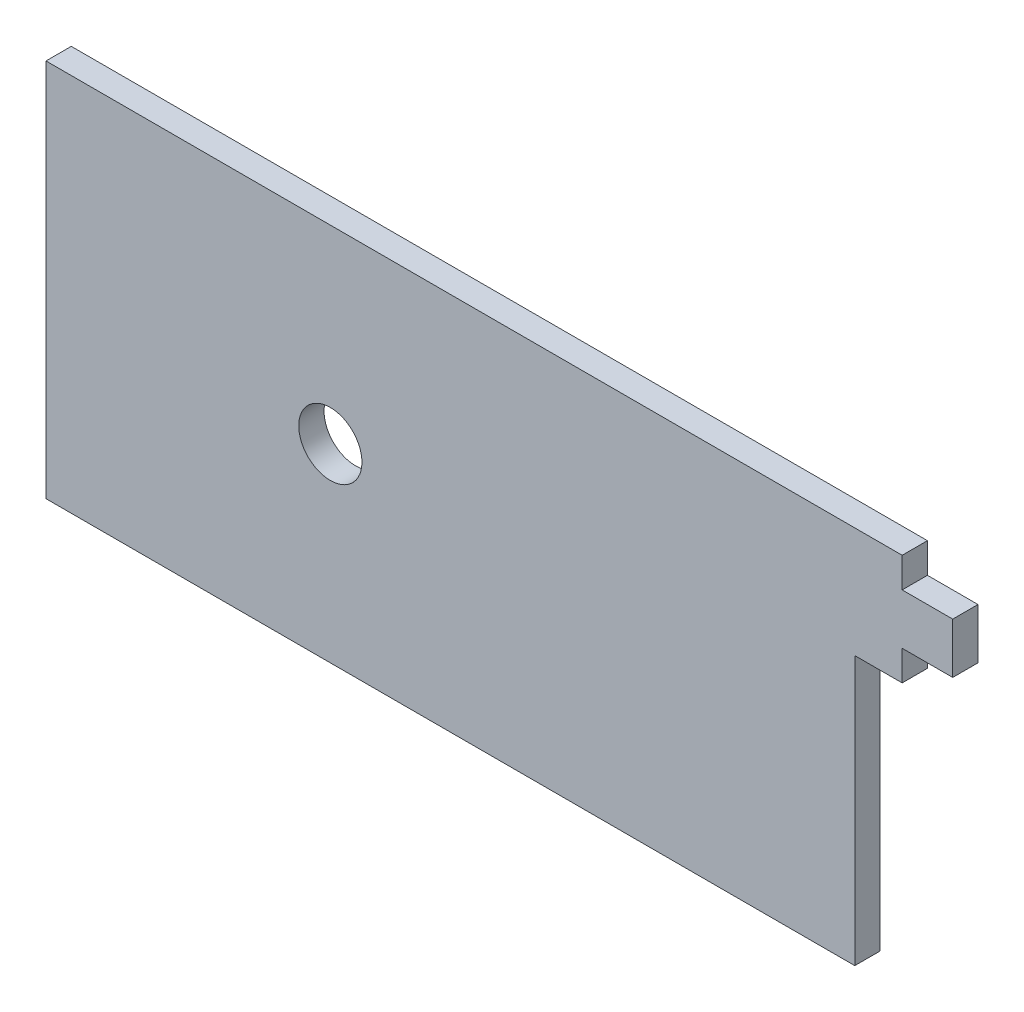
from build123d import *

# Parameters (mm, degrees)
SKETCH1_R           = 5
BOSS_EXTRUDE1_DEPTH = 4


with BuildPart() as part:
    # Sketch1 → Boss-Extrude1 (new body)
    with BuildSketch(Plane.XY):
        Polygon((47, 30), (54.5, 30), (54.5, 25.25), (62.5, 25.25), (62.5, 17.25), (54.5, 17.25), (54.5, 12.5), (47, 12.5), (47, -30), (-81, -30), (-81, 30), align=None)
        with Locations((-36, 0)):
            Circle(SKETCH1_R, mode=Mode.SUBTRACT)
    extrude(amount=BOSS_EXTRUDE1_DEPTH)


solid = part.part
